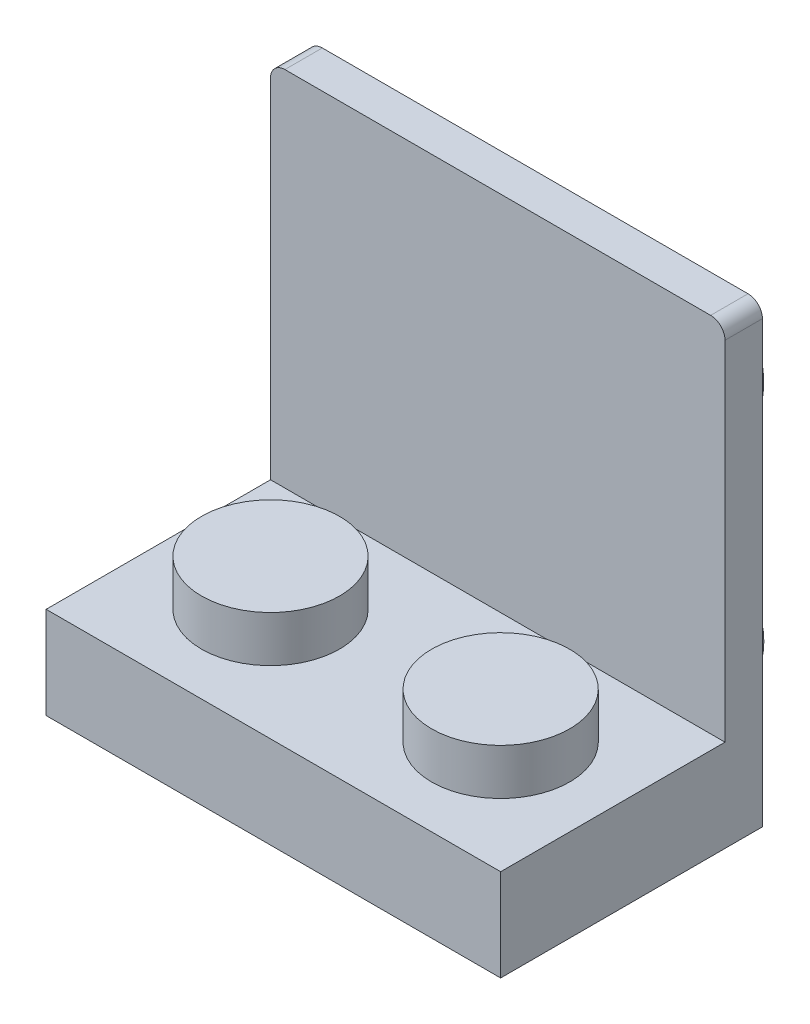
from build123d import *

# Parameters (mm, degrees)
SKETCH1_W                 = 15.8
SKETCH1_H                 = 3.2
BOSS_EXTRUDE1_DEPTH       = 7.8
SKETCH2_R                 = 2.4
BOSS_EXTRUDE2_DEPTH       = 1.6
LPATTERN1_COUNT           = 2
LPATTERN1_PITCH           = 8
LPATTERN1_COUNT_DIR2      = 4
LPATTERN1_PITCH_DIR2      = 8
SHELL1_T                  = -0.8
SKETCH3_R                 = 1.5
SKETCH3_R_2               = 0.6
BOSS_EXTRUDE3_DEPTH       = 2.2
SKETCH4_W                 = 15.8
SKETCH4_H                 = 7.9
BOSS_EXTRUDE4_DEPTH       = 1.3
SKETCH5_R                 = 2.35
SKETCH5_R_2               = 1.65
BOSS_EXTRUDE5_DEPTH       = 1.6
LPATTERN2_COUNT           = 2
LPATTERN2_PITCH           = 8
SKETCH7_W                 = 1.1
SKETCH7_H                 = 2.4
BOSS_EXTRUDE6_DEPTH       = 0.5
LPATTERN3_COUNT           = 3
LPATTERN3_PITCH           = 4
SKETCH8_W                 = 15.8
SKETCH8_H                 = 1.3
BOSS_EXTRUDE7_DEPTH       = 7.9
MIRROR1_COPY_1_SKETCH_R   = 2.35
MIRROR1_COPY_1_SKETCH_R_2 = 1.65
MIRROR1_COPY_1_DEPTH      = 1.6
FILLET2_R                 = 0.5


with BuildPart() as part:
    # Sketch1 → Boss-Extrude1 (new body)
    with BuildSketch(Plane.XY):
        with Locations((7.9, 1.6)):
            Rectangle(SKETCH1_W, SKETCH1_H)
    extrude(amount=-BOSS_EXTRUDE1_DEPTH)

    # Sketch2 → Boss-Extrude2 (add)
    with BuildSketch(Plane(origin=(0, 3.2, 0), x_dir=(1, 0, 0), z_dir=(0, 1, 0))):
        with Locations(Location((3.9, 3.9, 0), (0, 0, 270))):
            Circle(SKETCH2_R)
    boss_extrude2 = extrude(amount=BOSS_EXTRUDE2_DEPTH)

    # LPattern1: Boss-Extrude2 2 × 4, 6 skipped
    with Locations(*[(j * LPATTERN1_PITCH_DIR2, 0, i * LPATTERN1_PITCH) for i in range(LPATTERN1_COUNT) for j in range(LPATTERN1_COUNT_DIR2) if (i, j) not in ((0, 0), (0, 2), (0, 3), (1, 0), (1, 1), (1, 2), (1, 3))]):
        add(boss_extrude2)

    # Shell1
    shell1_openings = [part.faces().sort_by_distance(p)[0] for p in [
        (7.9, 0, -3.9),
    ]]
    offset(amount=SHELL1_T, openings=shell1_openings, kind=Kind.INTERSECTION)

    # Sketch3 → Boss-Extrude3 (add)
    with BuildSketch(Plane.XZ.offset(-2.4)):
        with Locations(Location((7.9, -3.9, 0), (0, 0, 90))):
            Circle(SKETCH3_R)
        with Locations(Location((7.9, -3.9, 0), (0, 0, 270))):
            Circle(SKETCH3_R_2, mode=Mode.SUBTRACT)
    extrude(amount=BOSS_EXTRUDE3_DEPTH)

    # Sketch4 → Boss-Extrude4 (add)
    with BuildSketch(Plane(origin=(0, 0, -7.8), x_dir=(-1, 0, 0), z_dir=(0, 0, -1))):
        with Locations((-7.9, 3.95)):
            Rectangle(SKETCH4_W, SKETCH4_H)
    extrude(amount=BOSS_EXTRUDE4_DEPTH)

    # Sketch5 → Boss-Extrude5 (add)
    with BuildSketch(Plane(origin=(0, 0, -9.1), x_dir=(-1, 0, 0), z_dir=(0, 0, -1))):
        with Locations(Location((-11.9, 4, 0), (0, 0, 180))):
            Circle(SKETCH5_R)
        with Locations((-11.9, 4)):
            Circle(SKETCH5_R_2, mode=Mode.SUBTRACT)
    boss_extrude5 = extrude(amount=BOSS_EXTRUDE5_DEPTH)

    # LPattern2: Boss-Extrude5 ×2
    with Locations(*[(-i * LPATTERN2_PITCH, 0, 0) for i in range(1, LPATTERN2_COUNT)]):
        add(boss_extrude5)

    # Sketch7 → Boss-Extrude6 (add)
    with BuildSketch(Plane.XY.offset(-7)):
        with Locations((11.9, 1.2)):
            Rectangle(SKETCH7_W, SKETCH7_H)
    boss_extrude6 = extrude(amount=BOSS_EXTRUDE6_DEPTH)

    # LPattern3: Boss-Extrude6 ×3
    with Locations(*[(-i * LPATTERN3_PITCH, 0, 0) for i in range(1, LPATTERN3_COUNT)]):
        add(boss_extrude6)

    # Sketch8 → Boss-Extrude7 (add)
    with BuildSketch(Plane(origin=(0, 7.9, 0), x_dir=(1, 0, 0), z_dir=(0, 1, 0))):
        with Locations((7.9, 8.45)):
            Rectangle(SKETCH8_W, SKETCH8_H)
    extrude(amount=BOSS_EXTRUDE7_DEPTH)

    # Mirror1: Boss-Extrude5 across plane
    add(boss_extrude5.mirror(Plane.ZX.offset(7.9)))

    # Mirror1 copy 1 sketch → Mirror1 copy 1 (add)
    with BuildSketch(Plane(origin=(-8, 15.8, -9.1), x_dir=(-1, 0, 0), z_dir=(0, 0, -1))):
        with Locations((-11.9, -4)):
            Circle(MIRROR1_COPY_1_SKETCH_R)
        with Locations((-11.9, -4)):
            Circle(MIRROR1_COPY_1_SKETCH_R_2, mode=Mode.SUBTRACT)
    extrude(amount=MIRROR1_COPY_1_DEPTH)

    # Fillet2
    fillet2_edges = [part.edges().sort_by_distance(p)[0] for p in [
        (0, 15.8, -8.45),
        (15.8, 15.8, -8.45),
    ]]
    fillet(fillet2_edges, radius=FILLET2_R)


solid = part.part
